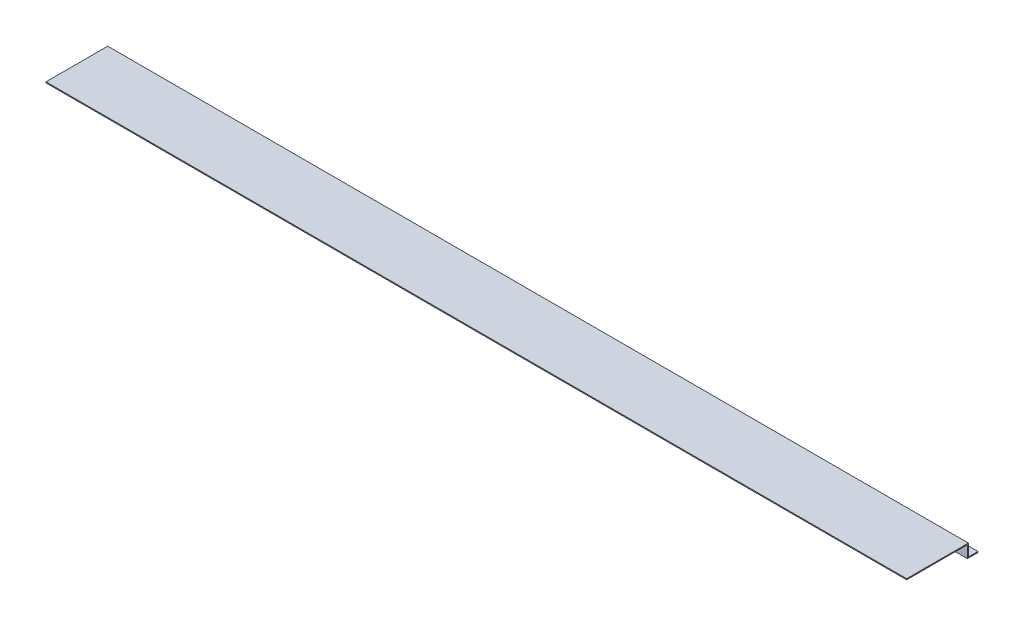
from build123d import *

# Parameters (mm, degrees)
BOSS_EXTRUDE2_DEPTH = 1785


with BuildPart() as part:
    # Sketch1 → Boss-Extrude2 (new body)
    with BuildSketch(Plane(origin=(0, 0, 0), x_dir=(0, 0, -1), z_dir=(1, 0, 0))):
        Polygon((0, 0), (128, 0), (128, -25), (148, -25), (148, -27), (126, -27), (126, -2), (0, -2), align=None)
    extrude(amount=BOSS_EXTRUDE2_DEPTH)


solid = part.part
